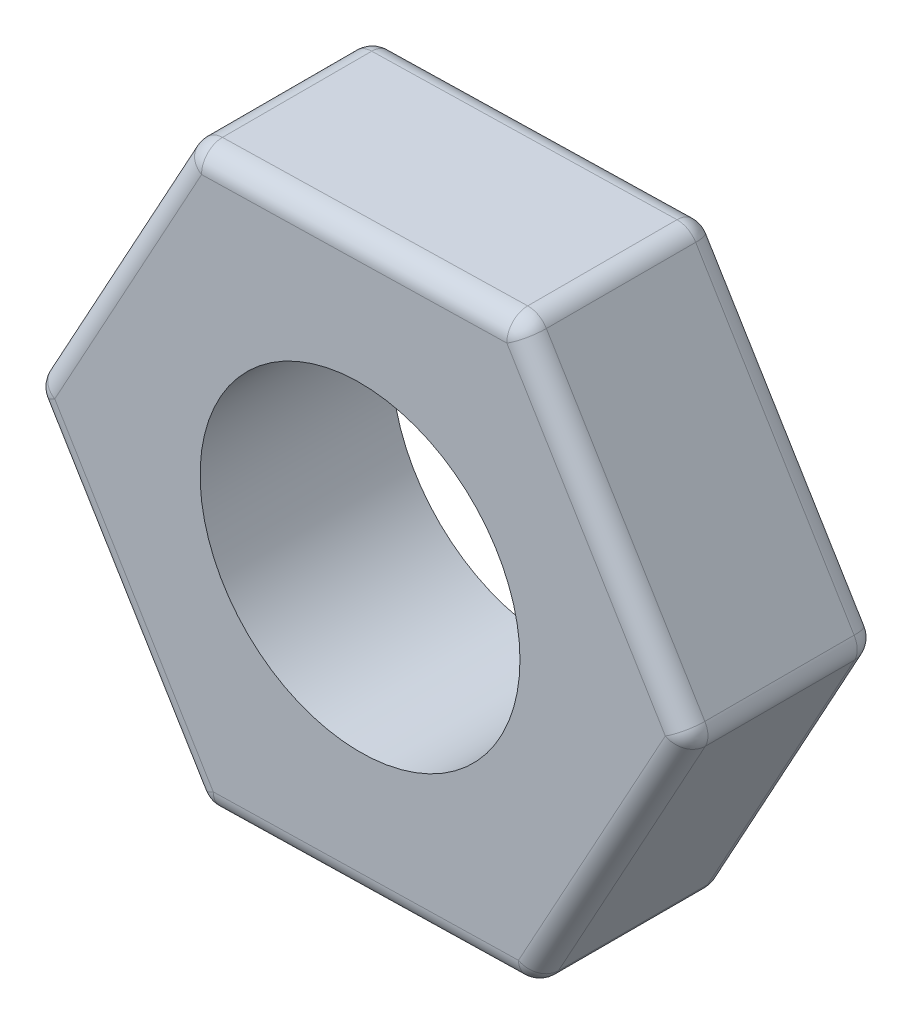
from build123d import *

# Parameters (mm, degrees)
SKETCH_1_R      = 1.5
EXTRUDE_1_DEPTH = 1.8
FILLET_2_R      = 0.2


with BuildPart() as part:
    # 草图1 → 凸台-拉伸1 (new body)
    with BuildSketch(Plane.XY):
        Polygon((-1.487983369, -2.713381438), (1.605865571, -2.645322117), (3.09384894, 0.068059321), (1.487983369, 2.713381438), (-1.605865571, 2.645322117), (-3.09384894, -0.068059321), align=None)
        Circle(SKETCH_1_R, mode=Mode.SUBTRACT)
    extrude(amount=EXTRUDE_1_DEPTH)

    # 圆角2
    fillet_2_edges = [part.edges().sort_by_distance(p)[0] for p in [
        (2.349857255, -1.288631398, 1.8),
        (-3.09384894, -0.068059321, 0.9),
        (-1.605865571, 2.645322117, 0.9),
        (1.487983369, 2.713381438, 0.9),
        (3.09384894, 0.068059321, 0.9),
        (1.605865571, -2.645322117, 0.9),
        (-1.487983369, -2.713381438, 0.9),
        (2.290916154, 1.390720379, 1.8),
        (-0.058941101, 2.679351777, 1.8),
        (-2.349857255, 1.288631398, 1.8),
        (-2.290916154, -1.390720379, 1.8),
        (-2.349857255, 1.288631398, 0),
        (-0.058941101, 2.679351777, 0),
        (2.290916154, 1.390720379, 0),
        (0.058941101, -2.679351777, 1.8),
        (2.349857255, -1.288631398, 0),
        (0.058941101, -2.679351777, 0),
        (-2.290916154, -1.390720379, 0),
    ]]
    fillet(fillet_2_edges, radius=FILLET_2_R)


solid = part.part
